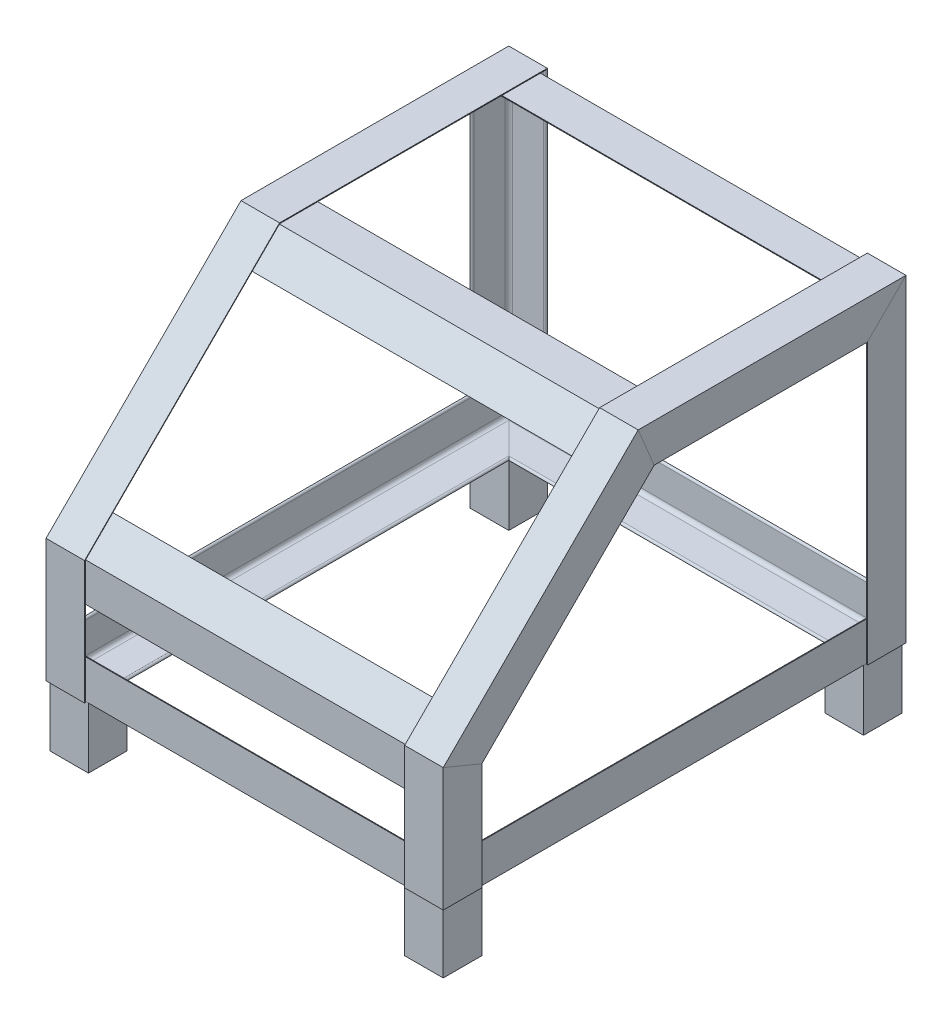
from build123d import *

# Parameters (mm, degrees)
NGULO_DE_EXTREMOS_REDONDEADOS_AL_I_AL_L_DEPTH      = 850.142792782
NGULO_DE_EXTREMOS_REDONDEADOS_AL_I_AL_L_DEPTH_BACK = 100.842792782
NGULO_DE_EXTREMOS_REDONDEADOS_AL_I_A_4_DEPTH       = 843.035585563
NGULO_DE_EXTREMOS_REDONDEADOS_AL_I_A_6_DEPTH       = 950.985585563
NGULO_DE_EXTREMOS_REDONDEADOS_AL_I_A_8_DEPTH       = 843.035585563
NGULO_DE_EXTREMOS_REDONDEADOS_AL_I_A_11_DEPTH      = 241.397438789
NGULO_DE_EXTREMOS_REDONDEADOS_AL_I_A_13_DEPTH      = 530.43662706
NGULO_DE_EXTREMOS_REDONDEADOS_AL_I_A_16_DEPTH      = 569.944
NGULO_DE_EXTREMOS_REDONDEADOS_AL_I_A_19_DEPTH      = 615.058561211
NGULO_DE_EXTREMOS_REDONDEADOS_AL_I_A_21_DEPTH      = 241.397438789
NGULO_DE_EXTREMOS_REDONDEADOS_AL_I_A_23_DEPTH      = 530.43662706
NGULO_DE_EXTREMOS_REDONDEADOS_AL_I_A_26_DEPTH      = 569.944
NGULO_DE_EXTREMOS_REDONDEADOS_AL_I_A_29_DEPTH      = 615.058561211
SALIENTE_EXTRUIR1_DEPTH                            = 647.7
SALIENTE_EXTRUIR1_2_DEPTH                          = 647.7
NGULO_DE_EXTREMOS_REDONDEADOS_AL_I_A_31_DEPTH      = 641.35
SKETCH113_W                                        = 63.5
SKETCH113_H                                        = 63.5
SKETCH113_W_2                                      = 50.8
SKETCH113_H_2                                      = 50.8
TUBO_CUADRADO_AL_AL_TUBE_2_5_SQR_X_0_25_DEPTH      = 100
SKETCH113_ON_SEGMENT_2_W                           = 63.5
SKETCH113_ON_SEGMENT_2_H                           = 63.5
SKETCH113_ON_SEGMENT_2_W_2                         = 50.8
SKETCH113_ON_SEGMENT_2_H_2                         = 50.8
TUBO_CUADRADO_AL_AL_TUBE_2_5_SQR_X_0_2_DEPTH       = 100
SKETCH113_ON_SEGMENT_3_W                           = 63.5
SKETCH113_ON_SEGMENT_3_H                           = 63.5
SKETCH113_ON_SEGMENT_3_W_2                         = 50.8
SKETCH113_ON_SEGMENT_3_H_2                         = 50.8
TUBO_CUADRADO_AL_AL_TUBE_2_5_SQR_X_0_3_DEPTH       = 100
SKETCH113_ON_SEGMENT_4_W                           = 63.5
SKETCH113_ON_SEGMENT_4_H                           = 63.5
SKETCH113_ON_SEGMENT_4_W_2                         = 50.8
SKETCH113_ON_SEGMENT_4_H_2                         = 50.8
TUBO_CUADRADO_AL_AL_TUBE_2_5_SQR_X_0_4_DEPTH       = 100


with BuildPart() as part:
    # Sketch1 → ngulo de extremos redondeados al i AL L (new, two sides: drawn at the far end of the back side and taken through both)
    with BuildSketch(Plane(origin=(-3.175, -9.525, -749.3), x_dir=(1, 0, 0), z_dir=(0, 0, 1)).offset(-NGULO_DE_EXTREMOS_REDONDEADOS_AL_I_AL_L_DEPTH_BACK)):
        with BuildLine():
            Line((0, 0), (0, 63.5))
            Line((0, 63.5), (0.00508, 63.5))
            ThreePointArc((0.00508, 63.5), (2.246551928, 62.571551928), (3.175, 60.33008))
            Line((3.175, 60.33008), (3.175, 9.525))
            ThreePointArc((3.175, 9.525), (5.034871939, 5.034871939), (9.525, 3.175))
            Line((9.525, 3.175), (60.33008, 3.175))
            ThreePointArc((60.33008, 3.175), (62.571551928, 2.246551928), (63.5, 0.00508))
            Line((63.5, 0.00508), (63.5, 0))
            Line((63.5, 0), (0, 0))
        make_face()
    extrude(amount=NGULO_DE_EXTREMOS_REDONDEADOS_AL_I_AL_L_DEPTH + NGULO_DE_EXTREMOS_REDONDEADOS_AL_I_AL_L_DEPTH_BACK)

    # ngulo de extremos redondeados al i A 2
    split(bisect_by=Plane(origin=(0, 0, -749.3), x_dir=(0, -1, 0), z_dir=(-0.707106781, 0, 0.707106781)), keep=Keep.TOP)

    # ngulo de extremos redondeados al i A 3
    split(bisect_by=Plane(origin=(0, 0, 0), x_dir=(0, -1, 0), z_dir=(-0.707106781, 0, -0.707106781)), keep=Keep.TOP)


with BuildPart() as body_2:
    # Sketch1 on segment 2 (carried to segment 2) → ngulo de extremos redondeados al i A 4 (new body)
    with BuildSketch(Plane(origin=(-100.842792782, -9.525, 3.175), x_dir=(0, 0, -1), z_dir=(1, 0, 0))):
        with BuildLine():
            Line((0, 0), (0, 63.5))
            Line((0, 63.5), (0.00508, 63.5))
            ThreePointArc((0.00508, 63.5), (2.246551928, 62.571551928), (3.175, 60.33008))
            Line((3.175, 60.33008), (3.175, 9.525))
            ThreePointArc((3.175, 9.525), (5.034871939, 5.034871939), (9.525, 3.175))
            Line((9.525, 3.175), (60.33008, 3.175))
            ThreePointArc((60.33008, 3.175), (62.571551928, 2.246551928), (63.5, 0.00508))
            Line((63.5, 0.00508), (63.5, 0))
            Line((63.5, 0), (0, 0))
        make_face()
    extrude(amount=NGULO_DE_EXTREMOS_REDONDEADOS_AL_I_A_4_DEPTH)

    # ngulo de extremos redondeados al i A 4 m
    split(bisect_by=Plane(origin=(641.35, 0, 0), x_dir=(0, -1, 0), z_dir=(-0.707106781, 0, 0.707106781)), keep=Keep.TOP)

    # ngulo de extremos redondeados al i A 5
    split(bisect_by=Plane(origin=(0, 0, 0), x_dir=(0, 1, 0), z_dir=(0.707106781, 0, 0.707106781)), keep=Keep.TOP)


with BuildPart() as body_3:
    # Sketch1 on segment 3 (carried to segment 3) → ngulo de extremos redondeados al i A 6 (new body)
    with BuildSketch(Plane(origin=(644.525, -9.525, 100.842792782), x_dir=(-1, 0, 0), z_dir=(0, 0, -1))):
        with BuildLine():
            Line((0, 0), (0, 63.5))
            Line((0, 63.5), (0.00508, 63.5))
            ThreePointArc((0.00508, 63.5), (2.246551928, 62.571551928), (3.175, 60.33008))
            Line((3.175, 60.33008), (3.175, 9.525))
            ThreePointArc((3.175, 9.525), (5.034871939, 5.034871939), (9.525, 3.175))
            Line((9.525, 3.175), (60.33008, 3.175))
            ThreePointArc((60.33008, 3.175), (62.571551928, 2.246551928), (63.5, 0.00508))
            Line((63.5, 0.00508), (63.5, 0))
            Line((63.5, 0), (0, 0))
        make_face()
    extrude(amount=NGULO_DE_EXTREMOS_REDONDEADOS_AL_I_A_6_DEPTH)

    # ngulo de extremos redondeados al i A 6 m
    split(bisect_by=Plane(origin=(641.35, 0, 0), x_dir=(0, 1, 0), z_dir=(0.707106781, 0, -0.707106781)), keep=Keep.TOP)

    # ngulo de extremos redondeados al i A 7
    split(bisect_by=Plane(origin=(641.35, 0, -749.3), x_dir=(0, 1, 0), z_dir=(0.707106781, 0, 0.707106781)), keep=Keep.TOP)


with BuildPart() as body_4:
    # Sketch1 on segment 4 (carried to segment 4) → ngulo de extremos redondeados al i A 8 (new body)
    with BuildSketch(Plane(origin=(742.192792782, -9.525, -752.475), x_dir=(0, 0, 1), z_dir=(-1, 0, 0))):
        with BuildLine():
            Line((0, 0), (0, 63.5))
            Line((0, 63.5), (0.00508, 63.5))
            ThreePointArc((0.00508, 63.5), (2.246551928, 62.571551928), (3.175, 60.33008))
            Line((3.175, 60.33008), (3.175, 9.525))
            ThreePointArc((3.175, 9.525), (5.034871939, 5.034871939), (9.525, 3.175))
            Line((9.525, 3.175), (60.33008, 3.175))
            ThreePointArc((60.33008, 3.175), (62.571551928, 2.246551928), (63.5, 0.00508))
            Line((63.5, 0.00508), (63.5, 0))
            Line((63.5, 0), (0, 0))
        make_face()
    extrude(amount=NGULO_DE_EXTREMOS_REDONDEADOS_AL_I_A_8_DEPTH)

    # ngulo de extremos redondeados al i A 8 m
    split(bisect_by=Plane(origin=(641.35, 0, -749.3), x_dir=(0, -1, 0), z_dir=(-0.707106781, 0, -0.707106781)), keep=Keep.TOP)

    # ngulo de extremos redondeados al i A 9
    split(bisect_by=Plane(origin=(0, 0, -749.3), x_dir=(0, 1, 0), z_dir=(0.707106781, 0, -0.707106781)), keep=Keep.TOP)


with BuildPart() as part_1:
    add(part.part)

    # ngulo de extremos redondeados al i A 10: union body 2, body 3, body 4
    add(body_2.part)
    add(body_3.part)
    add(body_4.part)


with BuildPart() as body_2_2:
    # Sketch12 → ngulo de extremos redondeados al i A 11 (new body)
    with BuildSketch(Plane(origin=(647.7, -9.525, 6.35), x_dir=(-1, 0, 0), z_dir=(0, -1, 0))):
        with BuildLine():
            Line((0, 0), (0, 63.5))
            Line((0, 63.5), (0.00508, 63.5))
            ThreePointArc((0.00508, 63.5), (2.246551928, 62.571551928), (3.175, 60.33008))
            Line((3.175, 60.33008), (3.175, 9.525))
            ThreePointArc((3.175, 9.525), (5.034871939, 5.034871939), (9.525, 3.175))
            Line((9.525, 3.175), (60.33008, 3.175))
            ThreePointArc((60.33008, 3.175), (62.571551928, 2.246551928), (63.5, 0.00508))
            Line((63.5, 0.00508), (63.5, 0))
            Line((63.5, 0), (0, 0))
        make_face()
    extrude(amount=-NGULO_DE_EXTREMOS_REDONDEADOS_AL_I_A_11_DEPTH)

    # ngulo de extremos redondeados al i A 12
    split(bisect_by=Plane(origin=(647.7, 193.675, 6.35), x_dir=(1, 0, 0), z_dir=(0, -0.923879533, 0.382683432)), keep=Keep.TOP)


with BuildPart() as body_3_2:
    # Sketch12 on segment 2 (carried to segment 2) → ngulo de extremos redondeados al i A 13 (new body)
    with BuildSketch(Plane(origin=(647.7, 541.740667992, -341.715667992), x_dir=(-1, 0, 0), z_dir=(0, -0.707106781, 0.707106781))):
        with BuildLine():
            Line((0, 0), (0, 63.5))
            Line((0, 63.5), (0.00508, 63.5))
            ThreePointArc((0.00508, 63.5), (2.246551928, 62.571551928), (3.175, 60.33008))
            Line((3.175, 60.33008), (3.175, 9.525))
            ThreePointArc((3.175, 9.525), (5.034871939, 5.034871939), (9.525, 3.175))
            Line((9.525, 3.175), (60.33008, 3.175))
            ThreePointArc((60.33008, 3.175), (62.571551928, 2.246551928), (63.5, 0.00508))
            Line((63.5, 0.00508), (63.5, 0))
            Line((63.5, 0), (0, 0))
        make_face()
    extrude(amount=NGULO_DE_EXTREMOS_REDONDEADOS_AL_I_A_13_DEPTH)

    # ngulo de extremos redondeados al i A 14
    split(bisect_by=Plane(origin=(647.7, 193.675, 6.35), x_dir=(-1, 0, 0), z_dir=(0, 0.923879533, -0.382683432)), keep=Keep.TOP)

    # ngulo de extremos redondeados al i A 15
    split(bisect_by=Plane(origin=(647.7, 514.731, -314.706), x_dir=(0, -0.923879533, -0.382683432), z_dir=(0, -0.382683432, 0.923879533)), keep=Keep.TOP)


with BuildPart() as body_4_2:
    # Sketch12 on segment 3 (carried to segment 3) → ngulo de extremos redondeados al i A 16 (new body)
    with BuildSketch(Plane(origin=(647.7, 514.731, -846.452561211), x_dir=(-1, 0, 0), z_dir=(0, 0, 1))):
        with BuildLine():
            Line((0, 0), (0, 63.5))
            Line((0, 63.5), (0.00508, 63.5))
            ThreePointArc((0.00508, 63.5), (2.246551928, 62.571551928), (3.175, 60.33008))
            Line((3.175, 60.33008), (3.175, 9.525))
            ThreePointArc((3.175, 9.525), (5.034871939, 5.034871939), (9.525, 3.175))
            Line((9.525, 3.175), (60.33008, 3.175))
            ThreePointArc((60.33008, 3.175), (62.571551928, 2.246551928), (63.5, 0.00508))
            Line((63.5, 0.00508), (63.5, 0))
            Line((63.5, 0), (0, 0))
        make_face()
    extrude(amount=NGULO_DE_EXTREMOS_REDONDEADOS_AL_I_A_16_DEPTH)

    # ngulo de extremos redondeados al i A 17
    split(bisect_by=Plane(origin=(647.7, 514.731, -314.706), x_dir=(0, 0.923879533, 0.382683432), z_dir=(0, 0.382683432, -0.923879533)), keep=Keep.TOP)

    # ngulo de extremos redondeados al i A 18
    split(bisect_by=Plane(origin=(647.7, 514.731, -755.65), x_dir=(-1, 0, 0), z_dir=(0, 0.707106781, 0.707106781)), keep=Keep.TOP)


with BuildPart() as body_5:
    # Sketch12 on segment 4 (carried to segment 4) → ngulo de extremos redondeados al i A 19 (new body)
    with BuildSketch(Plane(origin=(647.7, -9.525, -755.65), x_dir=(-1, 0, 0), z_dir=(0, 1, 0))):
        with BuildLine():
            Line((0, 0), (0, 63.5))
            Line((0, 63.5), (0.00508, 63.5))
            ThreePointArc((0.00508, 63.5), (2.246551928, 62.571551928), (3.175, 60.33008))
            Line((3.175, 60.33008), (3.175, 9.525))
            ThreePointArc((3.175, 9.525), (5.034871939, 5.034871939), (9.525, 3.175))
            Line((9.525, 3.175), (60.33008, 3.175))
            ThreePointArc((60.33008, 3.175), (62.571551928, 2.246551928), (63.5, 0.00508))
            Line((63.5, 0.00508), (63.5, 0))
            Line((63.5, 0), (0, 0))
        make_face()
    extrude(amount=NGULO_DE_EXTREMOS_REDONDEADOS_AL_I_A_19_DEPTH)

    # ngulo de extremos redondeados al i A 20
    split(bisect_by=Plane(origin=(647.7, 514.731, -755.65), x_dir=(1, 0, 0), z_dir=(0, -0.707106781, -0.707106781)), keep=Keep.TOP)


with BuildPart() as body_6:
    # Sketch17 → ngulo de extremos redondeados al i A 21 (new body)
    with BuildSketch(Plane(origin=(-6.35, -9.525, 6.35), x_dir=(1, 0, 0), z_dir=(0, 1, 0))):
        with BuildLine():
            Line((0, 0), (0, 63.5))
            Line((0, 63.5), (0.00508, 63.5))
            ThreePointArc((0.00508, 63.5), (2.246551928, 62.571551928), (3.175, 60.33008))
            Line((3.175, 60.33008), (3.175, 9.525))
            ThreePointArc((3.175, 9.525), (5.034871939, 5.034871939), (9.525, 3.175))
            Line((9.525, 3.175), (60.33008, 3.175))
            ThreePointArc((60.33008, 3.175), (62.571551928, 2.246551928), (63.5, 0.00508))
            Line((63.5, 0.00508), (63.5, 0))
            Line((63.5, 0), (0, 0))
        make_face()
    extrude(amount=NGULO_DE_EXTREMOS_REDONDEADOS_AL_I_A_21_DEPTH)

    # ngulo de extremos redondeados al i A 22
    split(bisect_by=Plane(origin=(-6.35, 193.675, 6.35), x_dir=(1, 0, 0), z_dir=(0, -0.923879533, 0.382683432)), keep=Keep.TOP)


with BuildPart() as body_7:
    # Sketch17 on segment 2 (carried to segment 2) → ngulo de extremos redondeados al i A 23 (new body)
    with BuildSketch(Plane(origin=(-6.35, 166.665332008, 33.359667992), x_dir=(1, 0, 0), z_dir=(0, 0.707106781, -0.707106781))):
        with BuildLine():
            Line((0, 0), (0, 63.5))
            Line((0, 63.5), (0.00508, 63.5))
            ThreePointArc((0.00508, 63.5), (2.246551928, 62.571551928), (3.175, 60.33008))
            Line((3.175, 60.33008), (3.175, 9.525))
            ThreePointArc((3.175, 9.525), (5.034871939, 5.034871939), (9.525, 3.175))
            Line((9.525, 3.175), (60.33008, 3.175))
            ThreePointArc((60.33008, 3.175), (62.571551928, 2.246551928), (63.5, 0.00508))
            Line((63.5, 0.00508), (63.5, 0))
            Line((63.5, 0), (0, 0))
        make_face()
    extrude(amount=NGULO_DE_EXTREMOS_REDONDEADOS_AL_I_A_23_DEPTH)

    # ngulo de extremos redondeados al i A 24
    split(bisect_by=Plane(origin=(-6.35, 193.675, 6.35), x_dir=(-1, 0, 0), z_dir=(0, 0.923879533, -0.382683432)), keep=Keep.TOP)

    # ngulo de extremos redondeados al i A 25
    split(bisect_by=Plane(origin=(-6.35, 514.731, -314.706), x_dir=(0, -0.923879533, -0.382683432), z_dir=(0, -0.382683432, 0.923879533)), keep=Keep.TOP)


with BuildPart() as body_8:
    # Sketch17 on segment 3 (carried to segment 3) → ngulo de extremos redondeados al i A 26 (new body)
    with BuildSketch(Plane(origin=(-6.35, 514.731, -276.508561211), x_dir=(1, 0, 0), z_dir=(0, 0, -1))):
        with BuildLine():
            Line((0, 0), (0, 63.5))
            Line((0, 63.5), (0.00508, 63.5))
            ThreePointArc((0.00508, 63.5), (2.246551928, 62.571551928), (3.175, 60.33008))
            Line((3.175, 60.33008), (3.175, 9.525))
            ThreePointArc((3.175, 9.525), (5.034871939, 5.034871939), (9.525, 3.175))
            Line((9.525, 3.175), (60.33008, 3.175))
            ThreePointArc((60.33008, 3.175), (62.571551928, 2.246551928), (63.5, 0.00508))
            Line((63.5, 0.00508), (63.5, 0))
            Line((63.5, 0), (0, 0))
        make_face()
    extrude(amount=NGULO_DE_EXTREMOS_REDONDEADOS_AL_I_A_26_DEPTH)

    # ngulo de extremos redondeados al i A 27
    split(bisect_by=Plane(origin=(-6.35, 514.731, -314.706), x_dir=(0, 0.923879533, 0.382683432), z_dir=(0, 0.382683432, -0.923879533)), keep=Keep.TOP)

    # ngulo de extremos redondeados al i A 28
    split(bisect_by=Plane(origin=(-6.35, 514.731, -755.65), x_dir=(-1, 0, 0), z_dir=(0, 0.707106781, 0.707106781)), keep=Keep.TOP)


with BuildPart() as body_9:
    # Sketch17 on segment 4 (carried to segment 4) → ngulo de extremos redondeados al i A 29 (new body)
    with BuildSketch(Plane(origin=(-6.35, 605.533561211, -755.65), x_dir=(1, 0, 0), z_dir=(0, -1, 0))):
        with BuildLine():
            Line((0, 0), (0, 63.5))
            Line((0, 63.5), (0.00508, 63.5))
            ThreePointArc((0.00508, 63.5), (2.246551928, 62.571551928), (3.175, 60.33008))
            Line((3.175, 60.33008), (3.175, 9.525))
            ThreePointArc((3.175, 9.525), (5.034871939, 5.034871939), (9.525, 3.175))
            Line((9.525, 3.175), (60.33008, 3.175))
            ThreePointArc((60.33008, 3.175), (62.571551928, 2.246551928), (63.5, 0.00508))
            Line((63.5, 0.00508), (63.5, 0))
            Line((63.5, 0), (0, 0))
        make_face()
    extrude(amount=NGULO_DE_EXTREMOS_REDONDEADOS_AL_I_A_29_DEPTH)

    # ngulo de extremos redondeados al i A 30
    split(bisect_by=Plane(origin=(-6.35, 514.731, -755.65), x_dir=(1, 0, 0), z_dir=(0, -0.707106781, -0.707106781)), keep=Keep.TOP)


with BuildPart() as body_10:
    # Croquis2 → Saliente-Extruir1 (new body)
    with BuildSketch(Plane(origin=(-3.175, 0, 0), x_dir=(0, 0, -1), z_dir=(1, 0, 0))):
        Polygon((-3.175, 192.359871939), (-3.175, 128.859871939), (1.5875, 128.859871939), (1.5875, 190.387179849), (45.093876651, 233.893556499), (41.726280605, 237.261152545), align=None)
    extrude(amount=SALIENTE_EXTRUIR1_DEPTH)


with BuildPart() as body_11:
    # Croquis2 → Saliente-Extruir1 2 (new body)
    with BuildSketch(Plane(origin=(-3.175, 0, 0), x_dir=(0, 0, -1), z_dir=(1, 0, 0))):
        Polygon((316.021128061, 511.556), (379.521128061, 511.556), (379.521128061, 506.7935), (317.993820151, 506.7935), (274.487443501, 463.287123349), (271.119847455, 466.654719395), align=None)
    extrude(amount=SALIENTE_EXTRUIR1_2_DEPTH)


with BuildPart() as body_12:
    # Sketch110 → ngulo de extremos redondeados al i A 31 (new body)
    with BuildSketch(Plane(origin=(0, 508.381, -749.3), x_dir=(0, -1, 0), z_dir=(-1, 0, 0))):
        with BuildLine():
            Line((0, 0), (0, 63.5))
            Line((0, 63.5), (0.00508, 63.5))
            ThreePointArc((0.00508, 63.5), (2.246551928, 62.571551928), (3.175, 60.33008))
            Line((3.175, 60.33008), (3.175, 9.525))
            ThreePointArc((3.175, 9.525), (5.034871939, 5.034871939), (9.525, 3.175))
            Line((9.525, 3.175), (60.33008, 3.175))
            ThreePointArc((60.33008, 3.175), (62.571551928, 2.246551928), (63.5, 0.00508))
            Line((63.5, 0.00508), (63.5, 0))
            Line((63.5, 0), (0, 0))
        make_face()
    extrude(amount=-NGULO_DE_EXTREMOS_REDONDEADOS_AL_I_A_31_DEPTH)


with BuildPart() as body_13:
    # Sketch113 → Tubo cuadrado al AL TUBE 2.5 SQR X 0.25 WALL(1) (new body)
    with BuildSketch(Plane(origin=(612.775, -9.525, -720.725), x_dir=(1, 0, 0), z_dir=(0, -1, 0))):
        Rectangle(SKETCH113_W, SKETCH113_H)
        Rectangle(SKETCH113_W_2, SKETCH113_H_2, mode=Mode.SUBTRACT)
    extrude(amount=TUBO_CUADRADO_AL_AL_TUBE_2_5_SQR_X_0_25_DEPTH)


with BuildPart() as body_14:
    # Sketch113 on segment 2 (carried to segment 2) → Tubo cuadrado al AL TUBE 2.5 SQR X 0 2 (new body)
    with BuildSketch(Plane(origin=(28.575, -9.525, -720.725), x_dir=(1, 0, 0), z_dir=(0, -1, 0))):
        Rectangle(SKETCH113_ON_SEGMENT_2_W, SKETCH113_ON_SEGMENT_2_H)
        Rectangle(SKETCH113_ON_SEGMENT_2_W_2, SKETCH113_ON_SEGMENT_2_H_2, mode=Mode.SUBTRACT)
    extrude(amount=TUBO_CUADRADO_AL_AL_TUBE_2_5_SQR_X_0_2_DEPTH)


with BuildPart() as body_15:
    # Sketch113 on segment 3 (carried to segment 3) → Tubo cuadrado al AL TUBE 2.5 SQR X 0 3 (new body)
    with BuildSketch(Plane(origin=(28.575, -9.525, -28.575), x_dir=(1, 0, 0), z_dir=(0, -1, 0))):
        Rectangle(SKETCH113_ON_SEGMENT_3_W, SKETCH113_ON_SEGMENT_3_H)
        Rectangle(SKETCH113_ON_SEGMENT_3_W_2, SKETCH113_ON_SEGMENT_3_H_2, mode=Mode.SUBTRACT)
    extrude(amount=TUBO_CUADRADO_AL_AL_TUBE_2_5_SQR_X_0_3_DEPTH)


with BuildPart() as body_16:
    # Sketch113 on segment 4 (carried to segment 4) → Tubo cuadrado al AL TUBE 2.5 SQR X 0 4 (new body)
    with BuildSketch(Plane(origin=(612.775, -9.525, -28.575), x_dir=(1, 0, 0), z_dir=(0, -1, 0))):
        Rectangle(SKETCH113_ON_SEGMENT_4_W, SKETCH113_ON_SEGMENT_4_H)
        Rectangle(SKETCH113_ON_SEGMENT_4_W_2, SKETCH113_ON_SEGMENT_4_H_2, mode=Mode.SUBTRACT)
    extrude(amount=TUBO_CUADRADO_AL_AL_TUBE_2_5_SQR_X_0_4_DEPTH)


solid = Compound([part_1.part, body_2_2.part, body_3_2.part, body_4_2.part, body_5.part, body_6.part, body_7.part, body_8.part, body_9.part, body_10.part, body_11.part, body_12.part, body_13.part, body_14.part, body_15.part, body_16.part])
